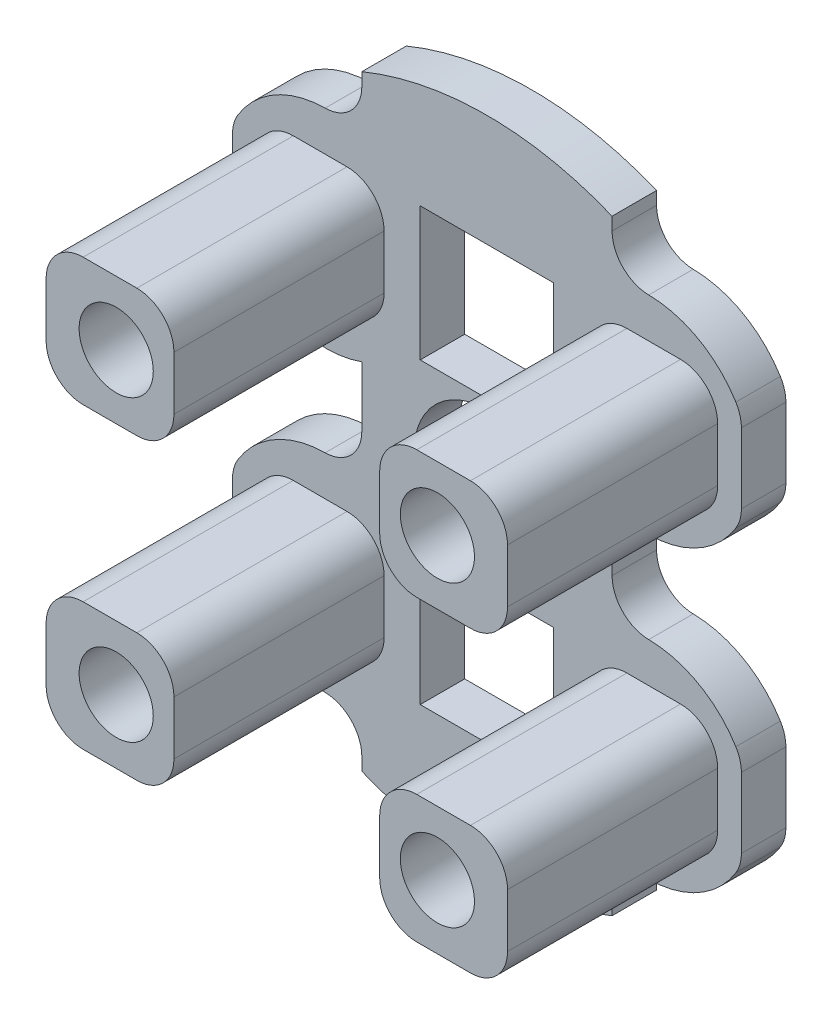
from build123d import *

# Parameters (mm, degrees)
SKETCH3_W               = 9
SKETCH3_H               = 9
SKETCH3_R               = 4.9125
BOSS_EXTRUDE1_DEPTH     = 3
SKETCH4_W               = 8.618657178
SKETCH4_H               = 8.618657178
BOSS_EXTRUDE2_DEPTH     = 14.17
CUT_EXTRUDE1_DEPTH      = 33.82652943
MIRROR2_COPY_1_SKETCH_W = 8.618657178
MIRROR2_COPY_1_SKETCH_H = 8.618657178
MIRROR2_COPY_1_DEPTH    = 14.17
MIRROR2_COPY_2_DEPTH    = 33.82652943
CUT_EXTRUDE2_START      = -15
CUT_EXTRUDE2_DEPTH      = 15
FILLET1_R               = 2.5


with BuildPart() as part:
    # Sketch3 → Boss-Extrude1 (new body)
    # profile 1 of 3: a face of its own
    with BuildSketch(Plane.XY):
        with BuildLine():
            ThreePointArc((-17.156985004, -13.930106446), (-12.214304958, -18.41794653), (-6.156985004, -21.225021453))
            Line((-6.156985004, -21.225021453), (-6.156985004, 21.225021453))
            ThreePointArc((-6.156985004, 21.225021453), (-12.214304958, 18.41794653), (-17.156985004, 13.930106446))
            Line((-17.156985004, 13.930106446), (-17.156985004, -13.930106446))
        make_face()
    # profile 2 of 3: a face of its own
    with BuildSketch(Plane.XY):
        with BuildLine():
            ThreePointArc((-6.156985004, -21.225021453), (0, -22.1), (6.156985004, -21.225021453))
            Line((6.156985004, -21.225021453), (6.156985004, 21.225021453))
            ThreePointArc((6.156985004, 21.225021453), (0, 22.1), (-6.156985004, 21.225021453))
            Line((-6.156985004, 21.225021453), (-6.156985004, -21.225021453))
        make_face()
        with Locations((0, -10.0625)):
            Rectangle(SKETCH3_W, SKETCH3_H, mode=Mode.SUBTRACT)
        Circle(SKETCH3_R, mode=Mode.SUBTRACT)
        with Locations((0, 10.0625)):
            Rectangle(SKETCH3_W, SKETCH3_H, mode=Mode.SUBTRACT)
    # profile 3 of 3: a face of its own
    with BuildSketch(Plane.XY):
        with BuildLine():
            Line((6.156985004, 21.225021453), (6.156985004, -21.225021453))
            ThreePointArc((6.156985004, -21.225021453), (12.214304958, -18.41794653), (17.156985004, -13.930106446))
            Line((17.156985004, -13.930106446), (17.156985004, 13.930106446))
            ThreePointArc((17.156985004, 13.930106446), (12.214304958, 18.41794653), (6.156985004, 21.225021453))
        make_face()
    extrude(amount=-BOSS_EXTRUDE1_DEPTH)

    # Sketch4 → Boss-Extrude2 (add)
    with BuildSketch(Plane.XY):
        with Locations((11.246006372, 10.0625)):
            Rectangle(SKETCH4_W, SKETCH4_H)
    boss_extrude2 = extrude(amount=BOSS_EXTRUDE2_DEPTH)

    # Sketch5 → Cut-Extrude1 (cut, through all)
    with BuildSketch(Plane(origin=(0, 0, -3), x_dir=(-1, 0, 0), z_dir=(0, 0, -1))):
        with BuildLine():
            Line((-10.828492502, 10.0625), (-8.328492502, 10.0625))
            ThreePointArc((-8.328492502, 10.0625), (-9.060725549, 11.830266953), (-10.828492502, 12.5625))
            Line((-10.828492502, 12.5625), (-10.828492502, 10.0625))
        make_face()
        with BuildLine():
            Line((-13.328492502, 10.0625), (-10.828492502, 10.0625))
            Line((-10.828492502, 10.0625), (-10.828492502, 12.5625))
            ThreePointArc((-10.828492502, 12.5625), (-12.596259455, 11.830266953), (-13.328492502, 10.0625))
        make_face()
        with BuildLine():
            ThreePointArc((-13.328492502, 10.0625), (-10.828492502, 7.5625), (-8.328492502, 10.0625))
            Line((-8.328492502, 10.0625), (-10.828492502, 10.0625))
            Line((-10.828492502, 10.0625), (-13.328492502, 10.0625))
        make_face()
    cut_extrude1 = extrude(amount=-CUT_EXTRUDE1_DEPTH, mode=Mode.SUBTRACT)

    # Mirror1: Boss-Extrude2, Cut-Extrude1 across plane
    add(boss_extrude2.mirror(Plane.ZX))
    add(cut_extrude1.mirror(Plane.ZX), mode=Mode.SUBTRACT)

    # Mirror2: Boss-Extrude2, Cut-Extrude1 across plane
    add(boss_extrude2.mirror(Plane(origin=(0, 0, 0), x_dir=(0, 0, 1), z_dir=(1, 0, 0))))
    add(cut_extrude1.mirror(Plane(origin=(0, 0, 0), x_dir=(0, 0, 1), z_dir=(1, 0, 0))), mode=Mode.SUBTRACT)

    # Mirror2 copy 1 sketch → Mirror2 copy 1 (add)
    with BuildSketch(Plane(origin=(0, 0, 0), x_dir=(-1, 0, 0), z_dir=(0, 0, 1))):
        with Locations((11.246006372, 10.0625)):
            Rectangle(MIRROR2_COPY_1_SKETCH_W, MIRROR2_COPY_1_SKETCH_H)
    extrude(amount=MIRROR2_COPY_1_DEPTH)

    # Mirror2 copy 2 sketch → Mirror2 copy 2 (cut, through all)
    with BuildSketch(Plane(origin=(0, 0, -3), x_dir=(1, 0, 0), z_dir=(0, 0, -1))):
        with BuildLine():
            Line((-10.828492502, 10.0625), (-8.328492502, 10.0625))
            ThreePointArc((-8.328492502, 10.0625), (-9.060725549, 11.830266953), (-10.828492502, 12.5625))
            Line((-10.828492502, 12.5625), (-10.828492502, 10.0625))
        make_face()
        with BuildLine():
            Line((-13.328492502, 10.0625), (-10.828492502, 10.0625))
            Line((-10.828492502, 10.0625), (-10.828492502, 12.5625))
            ThreePointArc((-10.828492502, 12.5625), (-12.596259455, 11.830266953), (-13.328492502, 10.0625))
        make_face()
        with BuildLine():
            ThreePointArc((-13.328492502, 10.0625), (-10.828492502, 7.5625), (-8.328492502, 10.0625))
            Line((-8.328492502, 10.0625), (-10.828492502, 10.0625))
            Line((-10.828492502, 10.0625), (-13.328492502, 10.0625))
        make_face()
    extrude(amount=-MIRROR2_COPY_2_DEPTH, mode=Mode.SUBTRACT)

    # Sketch6 → Cut-Extrude2 (cut)
    with BuildSketch(Plane(origin=(0, 0, -3), x_dir=(-1, 0, 0), z_dir=(0, 0, -1)).offset(CUT_EXTRUDE2_START)):
        with BuildLine():
            Line((-8.436677783, -3.483805422), (-8.436677783, 3.483805422))
            ThreePointArc((-8.436677783, 3.483805422), (-13.491388738, 3.588785175), (-17.156985004, 7.070814412))
            Line((-17.156985004, 7.070814412), (-17.156985004, -7.070814412))
            ThreePointArc((-17.156985004, -7.070814412), (-13.491388738, -3.588785175), (-8.436677783, -3.483805422))
        make_face()
        with BuildLine():
            Line((-17.156985004, -13.054185588), (-17.156985004, -13.930106446))
            ThreePointArc((-17.156985004, -13.930106446), (-13.202610572, -17.722896888), (-8.436677783, -20.426269067))
            Line((-8.436677783, -20.426269067), (-8.436677783, -17.0625))
            Line((-8.436677783, -17.0625), (-10.828492502, -17.0625))
            ThreePointArc((-10.828492502, -17.0625), (-14.57403658, -15.976119835), (-17.156985004, -13.054185588))
        make_face()
        with BuildLine():
            ThreePointArc((8.436677783, -20.426269067), (13.202610572, -17.722896888), (17.156985004, -13.930106446))
            Line((17.156985004, -13.930106446), (17.156985004, -13.054185588))
            ThreePointArc((17.156985004, -13.054185588), (14.57403658, -15.976119835), (10.828492502, -17.0625))
            Line((10.828492502, -17.0625), (8.436677783, -17.0625))
            Line((8.436677783, -17.0625), (8.436677783, -20.426269067))
        make_face()
        with BuildLine():
            ThreePointArc((17.156985004, 7.070814412), (13.491388738, 3.588785175), (8.436677783, 3.483805422))
            Line((8.436677783, 3.483805422), (8.436677783, 0))
            Line((8.436677783, 0), (8.436677783, -3.483805422))
            ThreePointArc((8.436677783, -3.483805422), (13.491388738, -3.588785175), (17.156985004, -7.070814412))
            Line((17.156985004, -7.070814412), (17.156985004, 7.070814412))
        make_face()
        with BuildLine():
            Line((-8.436677783, 17.0625), (-8.436677783, 20.426269067))
            ThreePointArc((-8.436677783, 20.426269067), (-13.202610572, 17.722896888), (-17.156985004, 13.930106446))
            Line((-17.156985004, 13.930106446), (-17.156985004, 13.054185588))
            ThreePointArc((-17.156985004, 13.054185588), (-14.57403658, 15.976119835), (-10.828492502, 17.0625))
            Line((-10.828492502, 17.0625), (-8.436677783, 17.0625))
        make_face()
        with BuildLine():
            ThreePointArc((17.156985004, 13.930106446), (13.202610572, 17.722896888), (8.436677783, 20.426269067))
            Line((8.436677783, 20.426269067), (8.436677783, 17.0625))
            Line((8.436677783, 17.0625), (10.828492502, 17.0625))
            ThreePointArc((10.828492502, 17.0625), (14.57403658, 15.976119835), (17.156985004, 13.054185588))
            Line((17.156985004, 13.054185588), (17.156985004, 13.930106446))
        make_face()
    extrude(amount=CUT_EXTRUDE2_DEPTH, mode=Mode.SUBTRACT)

    # Fillet1
    fillet1_edges = [part.edges().sort_by_distance(p)[0] for p in [
        (8.436677783, 17.0625, -1.5),
        (17.156985004, 13.054185588, -1.5),
        (17.156985004, 7.070814412, -1.5),
        (8.436677783, 3.483805422, -1.5),
        (6.936677783, 14.371828589, 7.085),
        (6.936677783, 5.753171411, 7.085),
        (15.555334961, 5.753171411, 7.085),
        (15.555334961, 14.371828589, 7.085),
        (-8.436677783, 17.0625, -1.5),
        (-17.156985004, 7.070814412, -1.5),
        (-17.156985004, 13.054185588, -1.5),
        (-15.555334961, 14.371828589, 7.085),
        (-15.555334961, 5.753171411, 7.085),
        (-6.936677783, 14.371828589, 7.085),
        (-6.936677783, 5.753171411, 7.085),
        (-6.936677783, -5.753171411, 7.085),
        (-15.555334961, -5.753171411, 7.085),
        (-15.555334961, -14.371828589, 7.085),
        (-6.936677783, -14.371828589, 7.085),
        (-8.436677783, -3.483805422, -1.5),
        (-17.156985004, -13.054185588, -1.5),
        (-17.156985004, -7.070814412, -1.5),
        (-8.436677783, -17.0625, -1.5),
        (8.436677783, -17.0625, -1.5),
        (6.936677783, -5.753171411, 7.085),
        (6.936677783, -14.371828589, 7.085),
        (15.555334961, -14.371828589, 7.085),
        (15.555334961, -5.753171411, 7.085),
        (17.156985004, -13.054185588, -1.5),
        (17.156985004, -7.070814412, -1.5),
        (8.436677783, -3.483805422, -1.5),
    ]]
    fillet(fillet1_edges, radius=FILLET1_R)


solid = part.part
